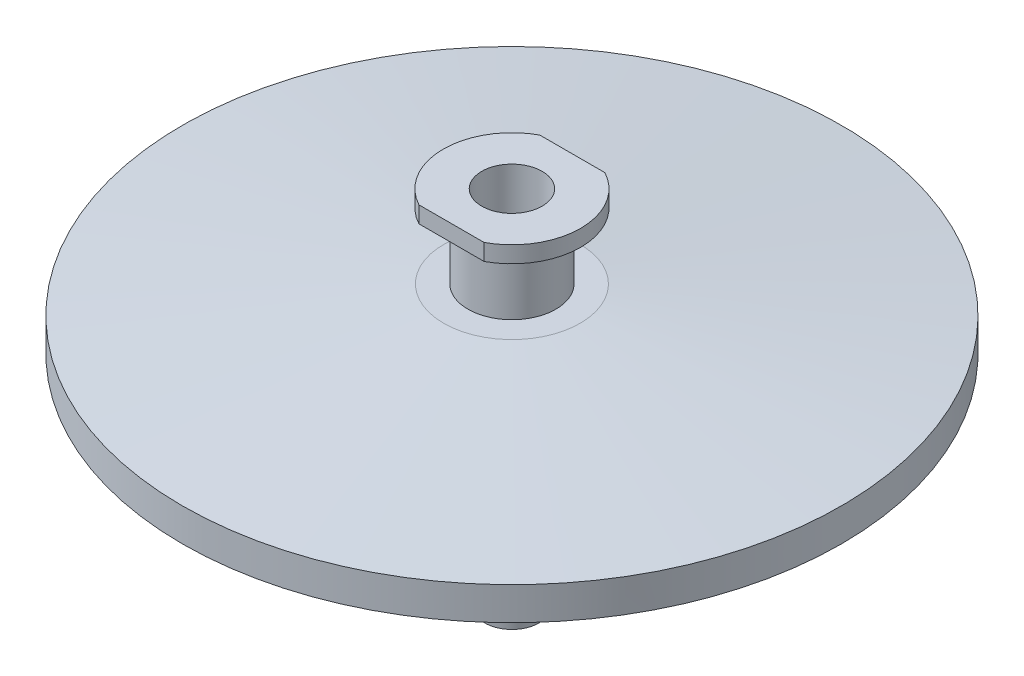
from build123d import *

# Parameters (mm, degrees)
BOSS_EXTRUDE1_DEPTH      = 0.762
BOSS_EXTRUDE1_DEPTH_BACK = 0.762
SKETCH1_R                = 15.24
BOSS_EXTRUDE2_DEPTH      = 0.127
BOSS_EXTRUDE2_DEPTH_BACK = 0.127
SKETCH2_R                = 13.97
SKETCH3_R                = 15.24
BOSS_EXTRUDE3_DEPTH      = 1.27
BOSS_EXTRUDE3_TAPER      = 84
SKETCH4_R                = 15.24
BOSS_EXTRUDE4_DEPTH      = 1.27
BOSS_EXTRUDE4_TAPER      = 84
SKETCH5_R                = 2.032
SKETCH5_R_2              = 1.397
BOSS_EXTRUDE5_DEPTH      = 3.81
BOSS_EXTRUDE6_START      = -0.762
SKETCH6_R                = 3.175
SKETCH6_R_2              = 2.032
BOSS_EXTRUDE6_DEPTH      = 0.762
CUT_EXTRUDE1_DEPTH       = 23.330341916
CUT_EXTRUDE1_DEPTH_BACK  = 23.330341916
SKETCH7_W                = 0.381
SKETCH7_H                = 0.762
SKETCH8_R                = 2.032
BOSS_EXTRUDE7_DEPTH      = 8.89
BOSS_EXTRUDE7_TAPER      = 5
SKETCH8_3_R              = 1.397
CUT_EXTRUDE2_DEPTH       = 8.89
CUT_EXTRUDE2_TAPER       = 5


with BuildPart() as part:
    # Sketch1 → Boss-Extrude1 (new, two sides: drawn at the far end of the back side and taken through both)
    with BuildSketch(Plane(origin=(0, 0, 0), x_dir=(1, 0, 0), z_dir=(0, 1, 0)).offset(-BOSS_EXTRUDE1_DEPTH_BACK)):
        Circle(SKETCH1_R)
    extrude(amount=BOSS_EXTRUDE1_DEPTH + BOSS_EXTRUDE1_DEPTH_BACK)

    # Sketch3 → Boss-Extrude3 (add)
    with BuildSketch(Plane(origin=(0, 0.762, 0), x_dir=(1, 0, 0), z_dir=(0, 1, 0))):
        Circle(SKETCH3_R)
    extrude(amount=BOSS_EXTRUDE3_DEPTH, taper=BOSS_EXTRUDE3_TAPER)

    # Sketch4 → Boss-Extrude4 (add)
    with BuildSketch(Plane.XZ.offset(0.762)):
        Circle(SKETCH4_R)
    extrude(amount=BOSS_EXTRUDE4_DEPTH, taper=BOSS_EXTRUDE4_TAPER)

    # Sketch5 → Boss-Extrude5 (add)
    with BuildSketch(Plane(origin=(0, 2.032, 0), x_dir=(1, 0, 0), z_dir=(0, 1, 0))):
        Circle(SKETCH5_R)
        Circle(SKETCH5_R_2, mode=Mode.SUBTRACT)
    extrude(amount=BOSS_EXTRUDE5_DEPTH)

    # Sketch6 → Boss-Extrude6 (add)
    with BuildSketch(Plane(origin=(0, 5.842, 0), x_dir=(1, 0, 0), z_dir=(0, 1, 0)).offset(BOSS_EXTRUDE6_START)):
        Circle(SKETCH6_R)
        Circle(SKETCH6_R_2, mode=Mode.SUBTRACT)
    extrude(amount=BOSS_EXTRUDE6_DEPTH)

    # Sketch7 → Cut-Extrude1 (cut, two sides: drawn at the far end of the back side and taken through both)
    with BuildSketch(Plane(origin=(0, 0, 0), x_dir=(0, 0, -1), z_dir=(1, 0, 0)).offset(-CUT_EXTRUDE1_DEPTH_BACK)):
        with Locations((-2.9845, 5.461)):
            Rectangle(SKETCH7_W, SKETCH7_H)
        with Locations((2.9845, 5.461)):
            Rectangle(SKETCH7_W, SKETCH7_H)
    extrude(amount=CUT_EXTRUDE1_DEPTH + CUT_EXTRUDE1_DEPTH_BACK, mode=Mode.SUBTRACT)

    # Sketch8 → Boss-Extrude7 (add)
    with BuildSketch(Plane.XZ.offset(2.032)):
        Circle(SKETCH8_R)
    extrude(amount=BOSS_EXTRUDE7_DEPTH, taper=BOSS_EXTRUDE7_TAPER)

    # Sketch8<3> → Cut-Extrude2 (cut)
    with BuildSketch(Plane.XZ.offset(2.032)):
        Circle(SKETCH8_3_R)
    extrude(amount=CUT_EXTRUDE2_DEPTH, taper=CUT_EXTRUDE2_TAPER, mode=Mode.SUBTRACT)


with BuildPart() as body_2:
    # Sketch2 → Boss-Extrude2 (new, two sides: drawn at the far end of the back side and taken through both)
    with BuildSketch(Plane(origin=(0, 0, 0), x_dir=(1, 0, 0), z_dir=(0, 1, 0)).offset(-BOSS_EXTRUDE2_DEPTH_BACK)):
        Circle(SKETCH2_R)
    extrude(amount=BOSS_EXTRUDE2_DEPTH + BOSS_EXTRUDE2_DEPTH_BACK)


solid = Compound([part.part, body_2.part])
